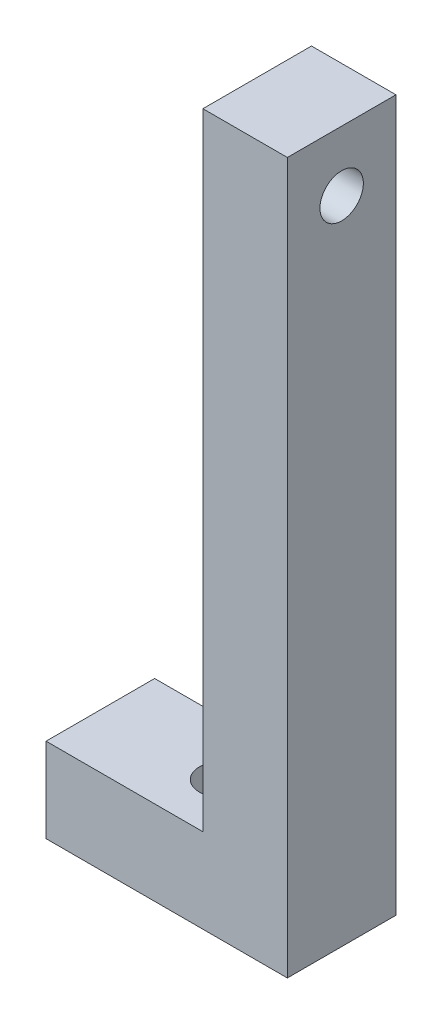
from build123d import *

# Parameters (mm, degrees)
ESQUISSE1_W             = 20
ESQUISSE1_H             = 7
ESQUISSE1_W_2           = 7
ESQUISSE1_H_2           = 51.9
BOSS_EXTRU_1_DEPTH      = 9
ESQUISSE2_R             = 1.8
ENL_V_MAT_EXTRU_1_DEPTH = 9
ESQUISSE3_R             = 1.8
ENL_V_MAT_EXTRU_2_DEPTH = 9


with BuildPart() as part:
    # Esquisse1 → Boss.-Extru.1 (new body)
    with BuildSketch(Plane.XY):
        with Locations((10, 3.5)):
            Rectangle(ESQUISSE1_W, ESQUISSE1_H)
        with Locations((16.5, 32.95)):
            Rectangle(ESQUISSE1_W_2, ESQUISSE1_H_2)
    extrude(amount=BOSS_EXTRU_1_DEPTH)

    # Esquisse2 → Enlèv. mat.-Extru.1 (cut)
    with BuildSketch(Plane(origin=(0, 7, 0), x_dir=(1, 0, 0), z_dir=(0, 1, 0))):
        with Locations(Location((10, -4.5, 0), (0, 0, 270))):
            Circle(ESQUISSE2_R)
    extrude(amount=-ENL_V_MAT_EXTRU_1_DEPTH, mode=Mode.SUBTRACT)

    # Esquisse3 → Enlèv. mat.-Extru.2 (cut)
    with BuildSketch(Plane.ZY.offset(-13)):
        with Locations(Location((4.5, 53.9, 0), (0, 0, 270))):
            Circle(ESQUISSE3_R)
    extrude(amount=-ENL_V_MAT_EXTRU_2_DEPTH, mode=Mode.SUBTRACT)


solid = part.part
